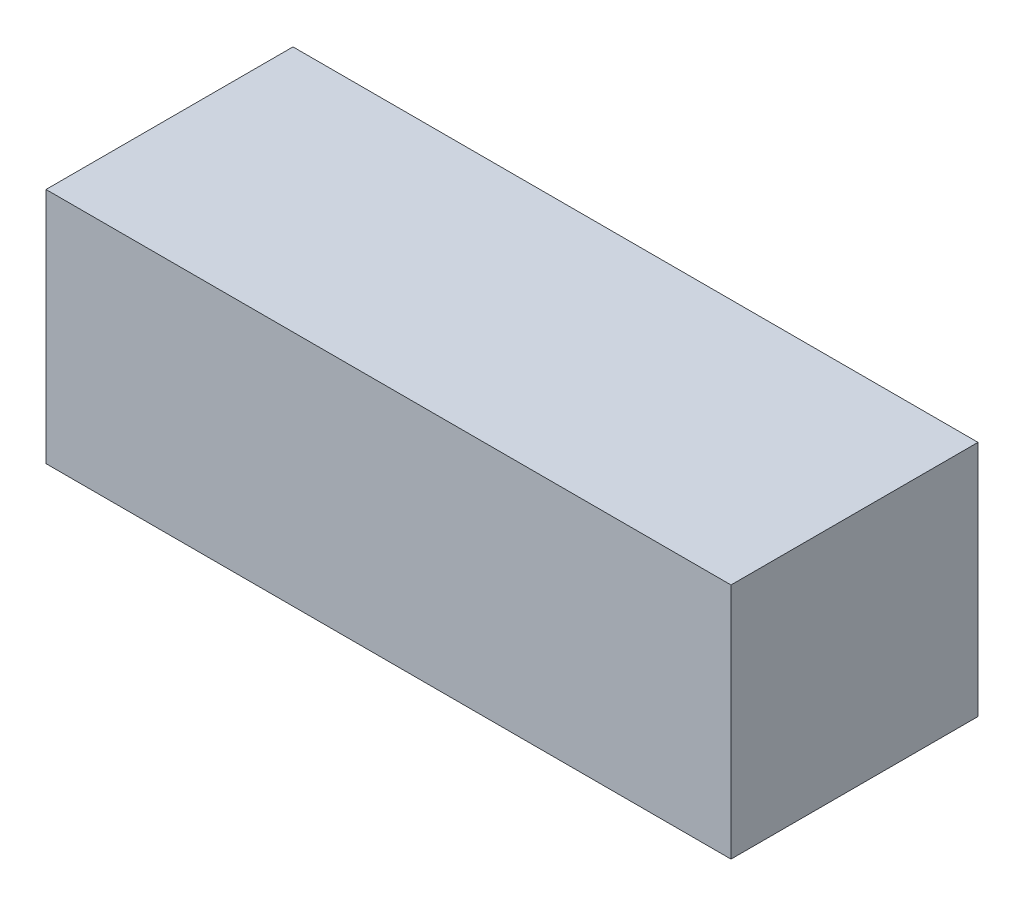
from build123d import *

# Parameters (mm, degrees)
SKETCH1_W           = 95.194979228
SKETCH1_H           = 34.325112702
BOSS_EXTRUDE1_DEPTH = 33


with BuildPart() as part:
    # Sketch1 → Boss-Extrude1 (new body)
    with BuildSketch(Plane(origin=(0, 0, 0), x_dir=(1, 0, 0), z_dir=(0, 1, 0))):
        Rectangle(SKETCH1_W, SKETCH1_H)
    extrude(amount=BOSS_EXTRUDE1_DEPTH)


solid = part.part
